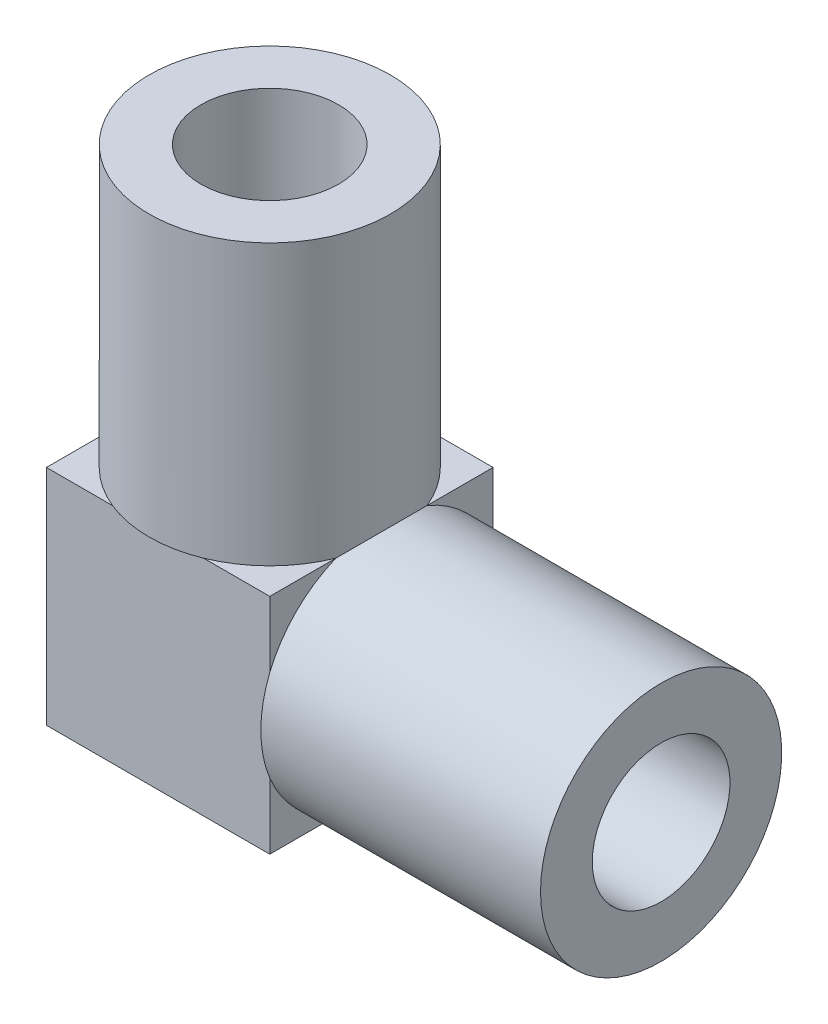
from build123d import *

# Parameters (mm, degrees)
BLOCK_SKETCH_W    = 20.6
BLOCK_SKETCH_H    = 20.6
BLOCK_DEPTH       = 10.3
ARM_X_SKETCH_W    = 25.8
ARM_X_SKETCH_H    = 11.124
ARM_Y_SKETCH_W    = 11.124
ARM_Y_SKETCH_H    = 25.8
SOCKET_X_SKETCH_W = 23.9
SOCKET_X_SKETCH_H = 6.35
SOCKET_Y_SKETCH_W = 6.35
SOCKET_Y_SKETCH_H = 23.9


with BuildPart() as part:
    # Block Sketch → Block (new, symmetric)
    with BuildSketch(Plane.XY):
        Rectangle(BLOCK_SKETCH_W, BLOCK_SKETCH_H)
    extrude(amount=BLOCK_DEPTH, both=True)

    # Arm X Sketch → Arm X (revolve)
    with BuildSketch(Plane.XY):
        with Locations((23.2, 5.562)):
            Rectangle(ARM_X_SKETCH_W, ARM_X_SKETCH_H)
    revolve(axis=Axis((-1000, 0, 0), (1, 0, 0)))

    # Arm Y Sketch → Arm Y (revolve)
    with BuildSketch(Plane.XY):
        with Locations((5.562, 23.2)):
            Rectangle(ARM_Y_SKETCH_W, ARM_Y_SKETCH_H)
    revolve(axis=Axis((0, -500, 0), (0, 1, 0)))

    # Socket X Sketch → Socket X (revolve, cut)
    with BuildSketch(Plane.XY):
        with Locations((25.15, 3.175)):
            Rectangle(SOCKET_X_SKETCH_W, SOCKET_X_SKETCH_H)
    revolve(axis=Axis((-1000, 0, 0), (1, 0, 0)), mode=Mode.SUBTRACT)

    # Socket Y Sketch → Socket Y (revolve, cut)
    with BuildSketch(Plane.XY):
        with Locations((3.175, 25.15)):
            Rectangle(SOCKET_Y_SKETCH_W, SOCKET_Y_SKETCH_H)
    revolve(axis=Axis((0, -500, 0), (0, 1, 0)), mode=Mode.SUBTRACT)


solid = part.part
